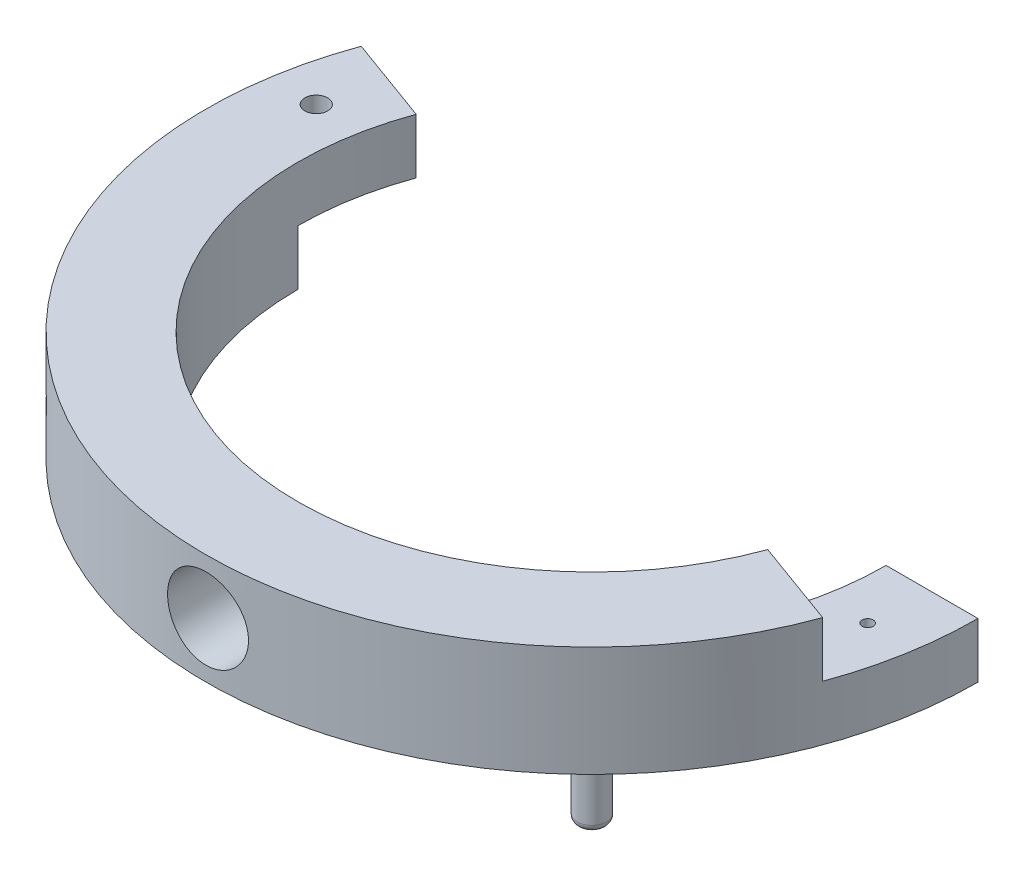
from build123d import *

# Parameters (mm, degrees)
BOSS_EXTRUDE1_DEPTH  = 30
BOSS_EXTRUDE2_START  = -15
BOSS_EXTRUDE2_DEPTH  = 15
CUT_EXTRUDE1_START   = -15
CUT_EXTRUDE1_DEPTH   = 15
SKETCH5_R            = 1.5
CUT_EXTRUDE2_DEPTH   = 15
SKETCH6_R            = 3.1
CUT_EXTRUDE3_DEPTH   = 5
SKETCH7_R            = 1.5
CUT_EXTRUDE4_DEPTH   = 15
SKETCH8_R            = 3.1
CUT_EXTRUDE5_DEPTH   = 5
SKETCH11_R           = 7.5
CUT_EXTRUDE6_DEPTH   = 30
SKETCH12_R           = 11
CUT_EXTRUDE7_DEPTH   = 20
SKETCH13_R           = 4
BOSS_EXTRUDE3_DEPTH  = 20
FILLET1_R            = 2
FILLET1_OF_MIRROR1_R = 2
SKETCH14_R           = 4
CUT_EXTRUDE8_DEPTH   = 40


with BuildPart() as part:
    # Sketch2 → Boss-Extrude1 (new body)
    with BuildSketch(Plane(origin=(0, 0, 0), x_dir=(1, 0, 0), z_dir=(0, 1, 0))):
        with BuildLine():
            Line((-105, 0), (-80, 0))
            ThreePointArc((-80, 0), (0, -80), (80, 0))
            Line((80, 0), (105, 0))
            ThreePointArc((105, 0), (0, -105), (-105, 0))
        make_face()
    extrude(amount=BOSS_EXTRUDE1_DEPTH)

    # Sketch3 → Boss-Extrude2 (add)
    with BuildSketch(Plane(origin=(0, 30, 0), x_dir=(1, 0, 0), z_dir=(0, 1, 0)).offset(BOSS_EXTRUDE2_START)):
        with BuildLine():
            Line((-98.667725183, 35.912115049), (-75.175409663, 27.361611466))
            ThreePointArc((-75.175409663, 27.361611466), (-78.784620241, 13.891854213), (-80, 0))
            Line((-80, 0), (-105, 0))
            ThreePointArc((-105, 0), (-103.404814066, 18.233058655), (-98.667725183, 35.912115049))
        make_face()
    extrude(amount=BOSS_EXTRUDE2_DEPTH)

    # Sketch4 → Cut-Extrude1 (cut)
    with BuildSketch(Plane(origin=(0, 30, 0), x_dir=(1, 0, 0), z_dir=(0, 1, 0)).offset(CUT_EXTRUDE1_START)):
        with BuildLine():
            Line((80, 0), (105, 0))
            ThreePointArc((105, 0), (103.404814066, -18.233058655), (98.667725183, -35.912115049))
            Line((98.667725183, -35.912115049), (75.175409663, -27.361611466))
            ThreePointArc((75.175409663, -27.361611466), (78.784620241, -13.891854213), (80, 0))
        make_face()
    extrude(amount=CUT_EXTRUDE1_DEPTH, mode=Mode.SUBTRACT)

    # Sketch5 → Cut-Extrude2 (cut)
    with BuildSketch(Plane(origin=(0, 15, 0), x_dir=(1, 0, 0), z_dir=(0, 1, 0))):
        with Locations(Location((91.088089232, -16.1, 0), (0, 0, 270))):
            Circle(SKETCH5_R)
    extrude(amount=-CUT_EXTRUDE2_DEPTH, mode=Mode.SUBTRACT)

    # Sketch6 → Cut-Extrude3 (cut)
    with BuildSketch(Plane(origin=(0, 0, 0), x_dir=(-1, 0, 0), z_dir=(0, -1, 0))):
        with Locations(Location((-91.088089232, -16.1, 0), (0, 0, 90))):
            Circle(SKETCH6_R)
    extrude(amount=-CUT_EXTRUDE3_DEPTH, mode=Mode.SUBTRACT)

    # Sketch7 → Cut-Extrude4 (cut)
    with BuildSketch(Plane.XZ.offset(-15)):
        with Locations(Location((-91.088089232, -16.1, 0), (0, 0, 270))):
            Circle(SKETCH7_R)
    extrude(amount=-CUT_EXTRUDE4_DEPTH, mode=Mode.SUBTRACT)

    # Sketch8 → Cut-Extrude5 (cut)
    with BuildSketch(Plane(origin=(0, 30, 0), x_dir=(1, 0, 0), z_dir=(0, 1, 0))):
        with Locations(Location((-91.088089232, 16.1, 0), (0, 0, 270))):
            Circle(SKETCH8_R)
    extrude(amount=-CUT_EXTRUDE5_DEPTH, mode=Mode.SUBTRACT)

    # Sketch11 → Cut-Extrude6 (cut)
    with BuildSketch(Plane.XY.offset(105)):
        with Locations((0, 15)):
            Circle(SKETCH11_R)
    extrude(amount=-CUT_EXTRUDE6_DEPTH, mode=Mode.SUBTRACT)

    # Sketch12 → Cut-Extrude7 (cut)
    with BuildSketch(Plane.XY.offset(105)):
        with Locations((0, 15)):
            Circle(SKETCH12_R)
    extrude(amount=-CUT_EXTRUDE7_DEPTH, mode=Mode.SUBTRACT)

    # Sketch13 → Boss-Extrude3 (add)
    with BuildSketch(Plane.XZ):
        with Locations(Location((-65.40737726, 65.40737726, 0), (0, 0, 270))):
            Circle(SKETCH13_R)
    boss_extrude3 = extrude(amount=BOSS_EXTRUDE3_DEPTH)

    # Fillet1
    fillet1_edges = [part.edges().sort_by_distance(p)[0] for p in [
        (-65.40737726, -20, 69.40737726),
    ]]
    fillet(fillet1_edges, radius=FILLET1_R)

    # Mirror1: Boss-Extrude3 across plane
    add(boss_extrude3.mirror(Plane(origin=(0, 0, 0), x_dir=(0, 0, 1), z_dir=(1, 0, 0))))

    # Fillet1 of Mirror1
    fillet1_of_mirror1_edges = [part.edges().sort_by_distance(p)[0] for p in [
        (65.40737726, -20, 69.40737726),
    ]]
    fillet(fillet1_of_mirror1_edges, radius=FILLET1_OF_MIRROR1_R)

    # Sketch14 → Cut-Extrude8 (cut)
    with BuildSketch(Plane(origin=(-74.246212025, 0, 74.246212025), x_dir=(0, -1, 0), z_dir=(-0.7071067811865488, 0, 0.7071067811865464))):
        with Locations(Location((-15, 0, 0), (0, 0, 90))):
            Circle(SKETCH14_R)
    extrude(amount=-CUT_EXTRUDE8_DEPTH, mode=Mode.SUBTRACT)


solid = part.part
